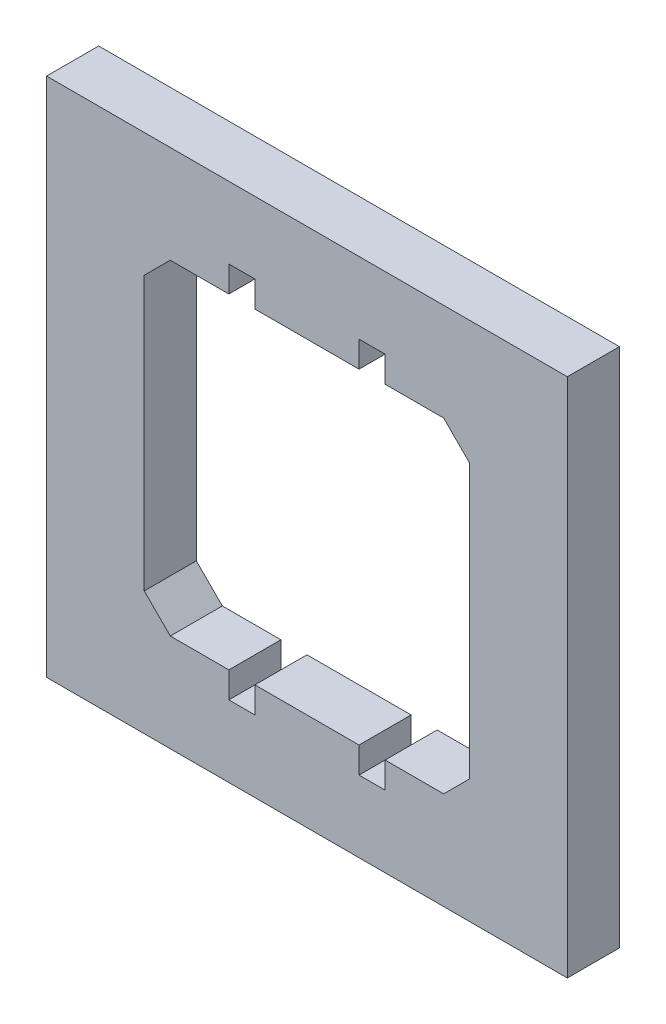
from build123d import *

# Parameters (mm, degrees)
SKETCH_2_W      = 20
SKETCH_2_H      = 20
EXTRUDE_1_DEPTH = 2
CHAMFER_1_SIZE  = 1


with BuildPart() as part:
    # 스케치2 → 보스-돌출1 (new body)
    with BuildSketch(Plane.XY):
        Rectangle(SKETCH_2_W, SKETCH_2_H)
        Polygon((-3, -6.25), (-6.25, -6.25), (-6.25, 6.25), (-3, 6.25), (-3, 7.25), (-2, 7.25), (-2, 6.25), (2, 6.25), (2, 7.25), (3, 7.25), (3, 6.25), (6.25, 6.25), (6.25, -6.25), (3, -6.25), (3, -7.25), (2, -7.25), (2, -6.25), (-2, -6.25), (-2, -7.25), (-3, -7.25), align=None, mode=Mode.SUBTRACT)
    extrude(amount=EXTRUDE_1_DEPTH)

    # 모따기1
    chamfer_1_edges = [part.edges().sort_by_distance(p)[0] for p in [
        (6.25, -6.25, 1),
        (6.25, 6.25, 1),
        (-6.25, 6.25, 1),
        (-6.25, -6.25, 1),
    ]]
    chamfer(chamfer_1_edges, length=CHAMFER_1_SIZE)


solid = part.part
